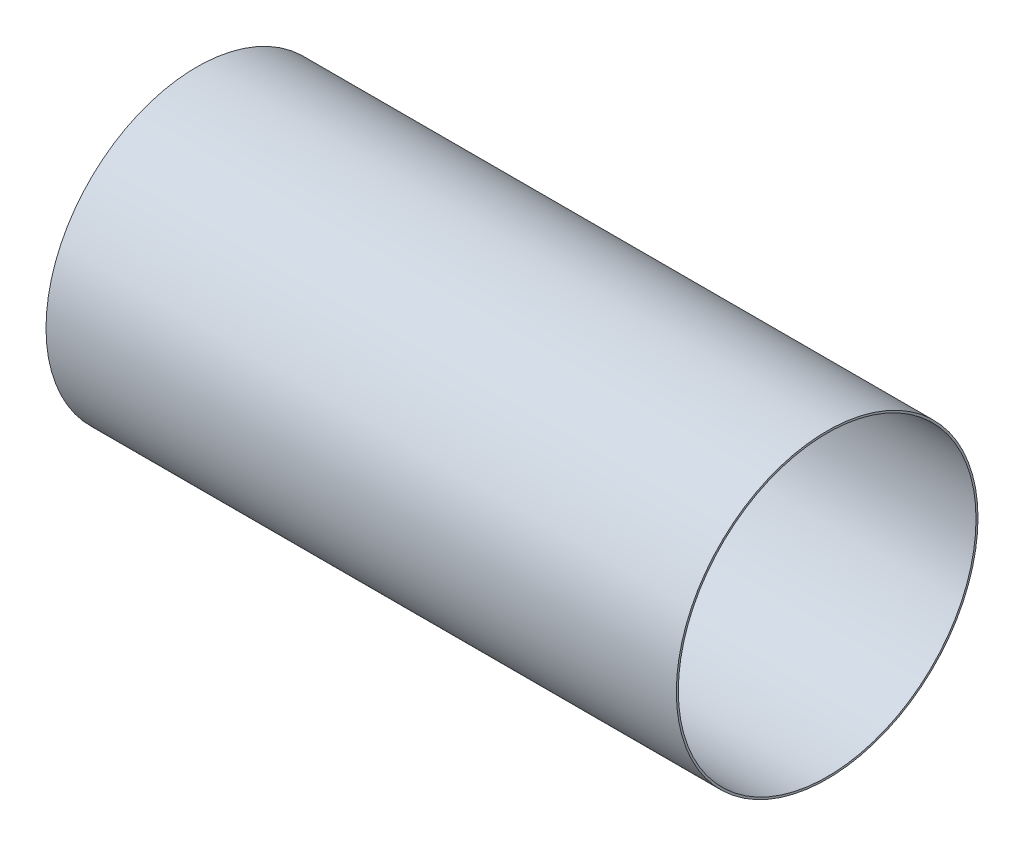
from build123d import *

# Parameters (mm, degrees)
SKETCH1_R           = 76
SKETCH1_R_2         = 75
BOSS_EXTRUDE1_DEPTH = 317.6


with BuildPart() as part:
    # Sketch1 → Boss-Extrude1 (new body)
    with BuildSketch(Plane(origin=(0, 0, 0), x_dir=(0, 0, -1), z_dir=(1, 0, 0))):
        Circle(SKETCH1_R)
        Circle(SKETCH1_R_2, mode=Mode.SUBTRACT)
    extrude(amount=BOSS_EXTRUDE1_DEPTH)


solid = part.part
